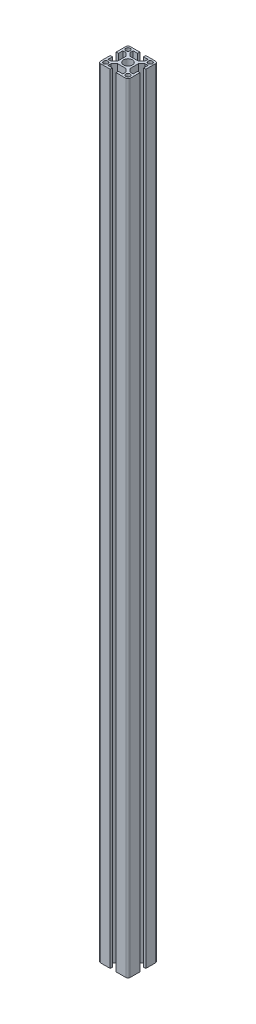
from build123d import *

# Parameters (mm, degrees)
SKETCH1_R           = 6
SKETCH1_R_2         = 3
BOSS_EXTRUDE1_DEPTH = 1050


with BuildPart() as part:
    # Sketch1 → Boss-Extrude1 (new body)
    with BuildSketch(Plane(origin=(0, 0, 0), x_dir=(1, 0, 0), z_dir=(0, 1, 0))):
        with BuildLine():
            Line((-20, -4), (-17, -4))
            Line((-17, -4), (-17, -10))
            Line((-17, -10), (-13, -10))
            Line((-13, -10), (-8.5, -5.5))
            Line((-8.5, -5.5), (-8.5, 5.5))
            Line((-8.5, 5.5), (-13, 10))
            Line((-13, 10), (-17, 10))
            Line((-17, 10), (-17, 4))
            Line((-17, 4), (-20, 4))
            Line((-20, 4), (-20, 17))
            ThreePointArc((-20, 17), (-19.121320344, 19.121320344), (-17, 20))
            Line((-17, 20), (-4, 20))
            Line((-4, 20), (-4, 17))
            Line((-4, 17), (-10, 17))
            Line((-10, 17), (-10, 13))
            Line((-10, 13), (-5.5, 8.5))
            Line((-5.5, 8.5), (5.5, 8.5))
            Line((5.5, 8.5), (10, 13))
            Line((10, 13), (10, 17))
            Line((10, 17), (4, 17))
            Line((4, 17), (4, 20))
            Line((4, 20), (17, 20))
            ThreePointArc((17, 20), (19.121320344, 19.121320344), (20, 17))
            Line((20, 17), (20, 4))
            Line((20, 4), (17, 4))
            Line((17, 4), (17, 10))
            Line((17, 10), (13, 10))
            Line((13, 10), (8.5, 5.5))
            Line((8.5, 5.5), (8.5, -5.5))
            Line((8.5, -5.5), (13, -10))
            Line((13, -10), (17, -10))
            Line((17, -10), (17, -4))
            Line((17, -4), (20, -4))
            Line((20, -4), (20, -17))
            ThreePointArc((20, -17), (19.121320344, -19.121320344), (17, -20))
            Line((17, -20), (4, -20))
            Line((4, -20), (4, -17))
            Line((4, -17), (10, -17))
            Line((10, -17), (10, -13))
            Line((10, -13), (5.5, -8.5))
            Line((5.5, -8.5), (-5.5, -8.5))
            Line((-5.5, -8.5), (-10, -13))
            Line((-10, -13), (-10, -17))
            Line((-10, -17), (-4, -17))
            Line((-4, -17), (-4, -20))
            Line((-4, -20), (-17, -20))
            ThreePointArc((-17, -20), (-19.121320344, -19.121320344), (-20, -17))
            Line((-20, -17), (-20, -4))
        make_face()
        with Locations(Location((0, 0, 0), (0, 0, 270))):
            Circle(SKETCH1_R, mode=Mode.SUBTRACT)
        with Locations(Location((-15, -15, 0), (0, 0, 270))):
            Circle(SKETCH1_R_2, mode=Mode.SUBTRACT)
        with Locations(Location((-15, 15, 0), (0, 0, 90))):
            Circle(SKETCH1_R_2, mode=Mode.SUBTRACT)
        with Locations(Location((15, 15, 0), (0, 0, 270))):
            Circle(SKETCH1_R_2, mode=Mode.SUBTRACT)
        with Locations(Location((15, -15, 0), (0, 0, 90))):
            Circle(SKETCH1_R_2, mode=Mode.SUBTRACT)
    extrude(amount=BOSS_EXTRUDE1_DEPTH)


solid = part.part
